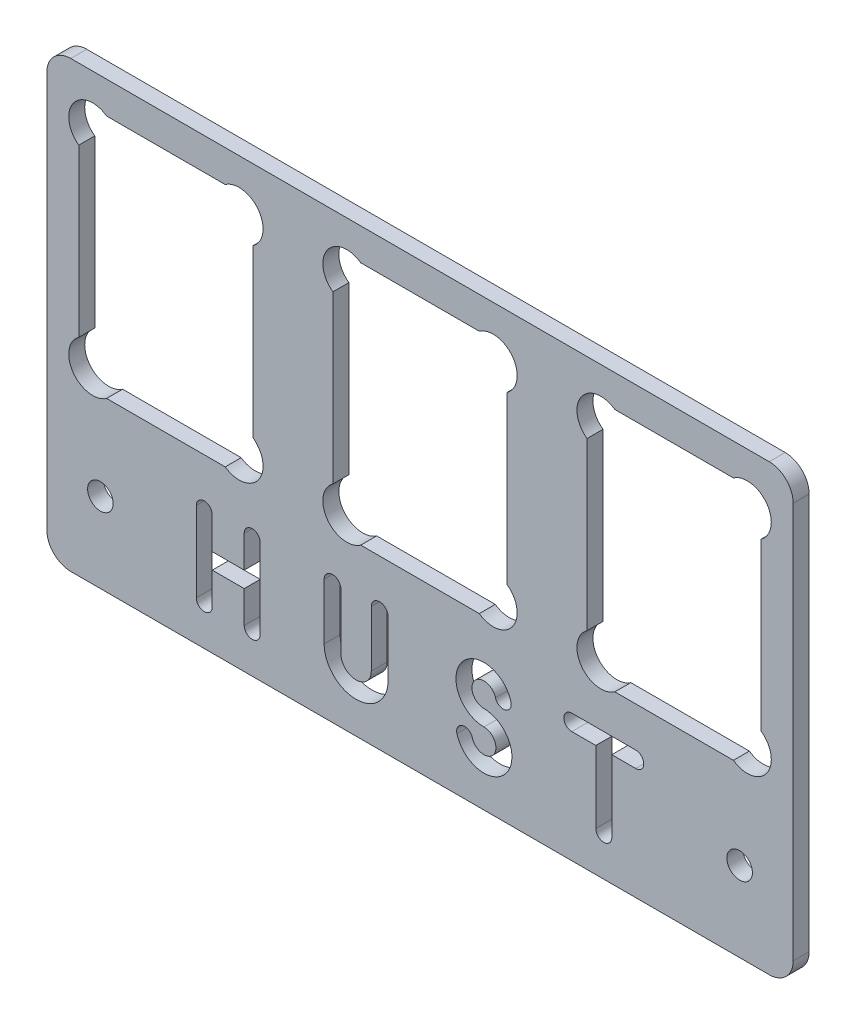
from build123d import *

# Parameters (mm, degrees)
SKETCH_1_W          = 93.4
SKETCH_1_H          = 55.6
SKETCH_1_R          = 1.6
EXTRUDE_1_DEPTH     = 2
CUT_EXTRUDE_1_DEPTH = 60.182598794
FILLET_1_R          = 3


with BuildPart() as part:
    # 草图1 → 凸台-拉伸1 (new body)
    with BuildSketch(Plane.XY):
        with Locations((0, -8.5)):
            Rectangle(SKETCH_1_W, SKETCH_1_H)
        with Locations((-40, -26.3)):
            Circle(SKETCH_1_R, mode=Mode.SUBTRACT)
        with Locations((40, -26.3)):
            Circle(SKETCH_1_R, mode=Mode.SUBTRACT)
        with BuildLine():
            ThreePointArc((-42.7, 10.41328679), (-43.95930804, 12.856643395), (-42.7, 15.3))
            ThreePointArc((-42.7, 15.3), (-40.95930804, 15.856643395), (-39.218616079, 15.3))
            Line((-39.218616079, 15.3), (-24.381383921, 15.3))
            ThreePointArc((-24.381383921, 15.3), (-22.64069196, 15.856643395), (-20.9, 15.3))
            ThreePointArc((-20.9, 15.3), (-19.974039013, 14.231038556), (-19.64069196, 12.856643395))
            ThreePointArc((-19.64069196, 12.856643395), (-19.974039013, 11.482248234), (-20.9, 10.41328679))
            Line((-20.9, 10.41328679), (-20.9, -10.41328679))
            ThreePointArc((-20.9, -10.41328679), (-19.974039013, -11.482248234), (-19.64069196, -12.856643395))
            ThreePointArc((-19.64069196, -12.856643395), (-19.974039013, -14.231038556), (-20.9, -15.3))
            ThreePointArc((-20.9, -15.3), (-22.64069196, -15.856643395), (-24.381383921, -15.3))
            Line((-24.381383921, -15.3), (-39.218616079, -15.3))
            ThreePointArc((-39.218616079, -15.3), (-40.95930804, -15.856643395), (-42.7, -15.3))
            ThreePointArc((-42.7, -15.3), (-43.95930804, -12.856643395), (-42.7, -10.41328679))
            Line((-42.7, -10.41328679), (-42.7, 10.41328679))
        make_face(mode=Mode.SUBTRACT)
        with BuildLine():
            ThreePointArc((-10.9, 10.41328679), (-12.15930804, 12.856643395), (-10.9, 15.3))
            ThreePointArc((-10.9, 15.3), (-9.15930804, 15.856643395), (-7.418616079, 15.3))
            Line((-7.418616079, 15.3), (7.418616079, 15.3))
            ThreePointArc((7.418616079, 15.3), (9.15930804, 15.856643395), (10.9, 15.3))
            ThreePointArc((10.9, 15.3), (11.825960987, 14.231038556), (12.15930804, 12.856643395))
            ThreePointArc((12.15930804, 12.856643395), (11.825960987, 11.482248234), (10.9, 10.41328679))
            Line((10.9, 10.41328679), (10.9, -10.41328679))
            ThreePointArc((10.9, -10.41328679), (11.825960987, -11.482248234), (12.15930804, -12.856643395))
            ThreePointArc((12.15930804, -12.856643395), (11.825960987, -14.231038556), (10.9, -15.3))
            ThreePointArc((10.9, -15.3), (9.15930804, -15.856643395), (7.418616079, -15.3))
            Line((7.418616079, -15.3), (-7.418616079, -15.3))
            ThreePointArc((-7.418616079, -15.3), (-9.15930804, -15.856643395), (-10.9, -15.3))
            ThreePointArc((-10.9, -15.3), (-12.15930804, -12.856643395), (-10.9, -10.41328679))
            Line((-10.9, -10.41328679), (-10.9, 10.41328679))
        make_face(mode=Mode.SUBTRACT)
        with BuildLine():
            ThreePointArc((20.9, 10.41328679), (19.64069196, 12.856643395), (20.9, 15.3))
            ThreePointArc((20.9, 15.3), (22.64069196, 15.856643395), (24.381383921, 15.3))
            Line((24.381383921, 15.3), (39.218616079, 15.3))
            ThreePointArc((39.218616079, 15.3), (40.95930804, 15.856643395), (42.7, 15.3))
            ThreePointArc((42.7, 15.3), (43.625960987, 14.231038556), (43.95930804, 12.856643395))
            ThreePointArc((43.95930804, 12.856643395), (43.625960987, 11.482248234), (42.7, 10.41328679))
            Line((42.7, 10.41328679), (42.7, -10.41328679))
            ThreePointArc((42.7, -10.41328679), (43.625960987, -11.482248234), (43.95930804, -12.856643395))
            ThreePointArc((43.95930804, -12.856643395), (43.625960987, -14.231038556), (42.7, -15.3))
            ThreePointArc((42.7, -15.3), (40.95930804, -15.856643395), (39.218616079, -15.3))
            Line((39.218616079, -15.3), (24.381383921, -15.3))
            ThreePointArc((24.381383921, -15.3), (22.64069196, -15.856643395), (20.9, -15.3))
            ThreePointArc((20.9, -15.3), (19.64069196, -12.856643395), (20.9, -10.41328679))
            Line((20.9, -10.41328679), (20.9, 10.41328679))
        make_face(mode=Mode.SUBTRACT)
    extrude(amount=EXTRUDE_1_DEPTH)

    # 草图2 → 切除-拉伸1 (cut, through all)
    with BuildSketch(Plane.XY.offset(2)):
        with BuildLine():
            Line((-28, -31.3), (-28, -21.3))
            ThreePointArc((-28, -21.3), (-27, -20.3), (-26, -21.3))
            Line((-26, -21.3), (-26, -25.3))
            Line((-26, -25.3), (-22, -25.3))
            Line((-22, -25.3), (-22, -21.3))
            ThreePointArc((-22, -21.3), (-21, -20.3), (-20, -21.3))
            Line((-20, -21.3), (-20, -31.3))
            ThreePointArc((-20, -31.3), (-21, -32.3), (-22, -31.3))
            Line((-22, -31.3), (-22, -27.3))
            Line((-22, -27.3), (-26, -27.3))
            Line((-26, -27.3), (-26, -31.3))
            ThreePointArc((-26, -31.3), (-27, -32.3), (-28, -31.3))
        make_face()
        with BuildLine():
            Line((-12, -21.3), (-12, -28.3))
            ThreePointArc((-12, -28.3), (-8, -32.3), (-4, -28.3))
            Line((-4, -28.3), (-4, -21.3))
            ThreePointArc((-4, -21.3), (-5.05, -20.25), (-6.1, -21.3))
            Line((-6.1, -21.3), (-6.1, -28.3))
            ThreePointArc((-6.1, -28.3), (-8, -30.2), (-9.9, -28.3))
            Line((-9.9, -28.3), (-9.9, -21.3))
            ThreePointArc((-9.9, -21.3), (-10.95, -20.25), (-12, -21.3))
        make_face()
        with BuildLine():
            Line((19, -22.3), (22, -22.3))
            Line((22, -22.3), (22, -31.3))
            ThreePointArc((22, -31.3), (23, -32.3), (24, -31.3))
            Line((24, -31.3), (24, -22.3))
            Line((24, -22.3), (27, -22.3))
            ThreePointArc((27, -22.3), (28, -21.3), (27, -20.3))
            Line((27, -20.3), (19, -20.3))
            ThreePointArc((19, -20.3), (18, -21.3), (19, -22.3))
        make_face()
        with BuildLine():
            ThreePointArc((8, -25.3), (10.776736691, -30.930665002), (4.619259608, -29.705866658))
            ThreePointArc((4.619259608, -29.705866658), (5.326366389, -28.481121786), (6.551111261, -29.188228568))
            ThreePointArc((6.551111261, -29.188228568), (9.19003001, -29.713142144), (8, -27.3))
            ThreePointArc((8, -27.3), (5.223263309, -21.669334998), (11.380740392, -22.894133342))
            ThreePointArc((11.380740392, -22.894133342), (10.673633611, -24.118878214), (9.448888739, -23.411771432))
            ThreePointArc((9.448888739, -23.411771432), (6.80996999, -22.886857856), (8, -25.3))
        make_face()
    extrude(amount=-CUT_EXTRUDE_1_DEPTH, mode=Mode.SUBTRACT)

    # 圆角1
    fillet_1_edges = [part.edges().sort_by_distance(p)[0] for p in [
        (-46.7, -36.3, 1),
        (-46.7, 19.3, 1),
        (46.7, 19.3, 1),
        (46.7, -36.3, 1),
    ]]
    fillet(fillet_1_edges, radius=FILLET_1_R)


solid = part.part
